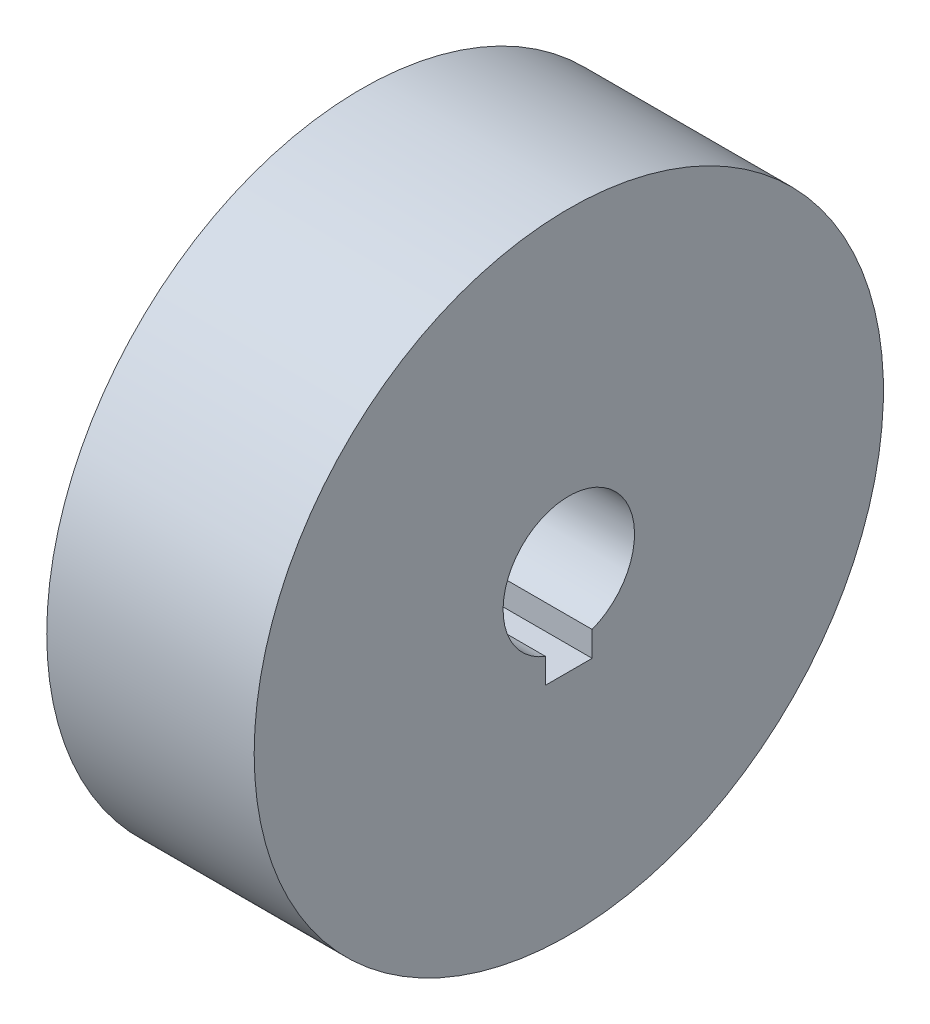
from build123d import *

# Parameters (mm, degrees)
SKETCH2_W          = 5.6237504
SKETCH2_H          = 5.000603239
CUT_EXTRUDE1_DEPTH = 50


with BuildPart() as part:
    # Sketch1 → Revolve-Thin1 (revolve)
    with BuildSketch(Plane.XY, mode=Mode.PRIVATE) as revolve_thin1_sk:
        Polygon((-35, -30), (-20, -30), (-20, -40), (-35, -40), (-35, -50), (-10, -50), (-10, -20), (-35, -20), align=None)
    revolve(revolve_thin1_sk.sketch.rotate(Axis((-102.944705745, -57.920177064, 0), (1, 0, 0)), 90), axis=Axis((-102.944705745, -57.920177064, 0), (1, 0, 0)))

    # Sketch2 → Cut-Extrude1 (cut)
    with BuildSketch(Plane.ZY.offset(35)):
        with Locations((0, -65.840354128)):
            Rectangle(SKETCH2_W, SKETCH2_H)
    extrude(amount=-CUT_EXTRUDE1_DEPTH, mode=Mode.SUBTRACT)


solid = part.part
